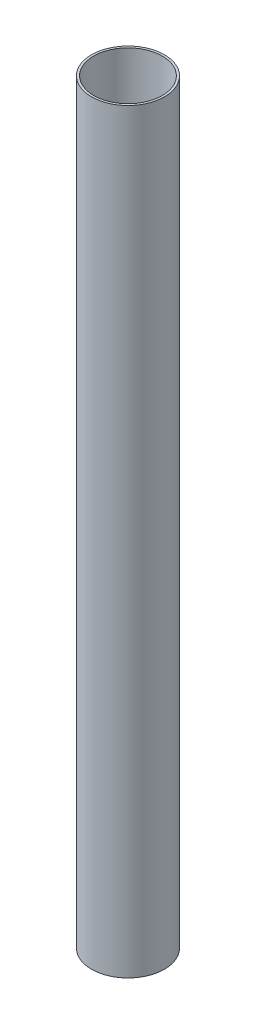
from build123d import *

# Parameters (mm, degrees)
SKETCH1_W = 3.175
SKETCH1_H = 1092.2


with BuildPart() as part:
    # Sketch1 → Revolve1 (revolve)
    with BuildSketch(Plane.XY, mode=Mode.PRIVATE) as revolve1_sk:
        with Locations((51.1175, 546.1)):
            Rectangle(SKETCH1_W, SKETCH1_H)
    revolve(revolve1_sk.sketch.rotate(Axis((0, 1146.81, 0), (0, -1, 0)), 90), axis=Axis((0, 1146.81, 0), (0, -1, 0)))


solid = part.part
